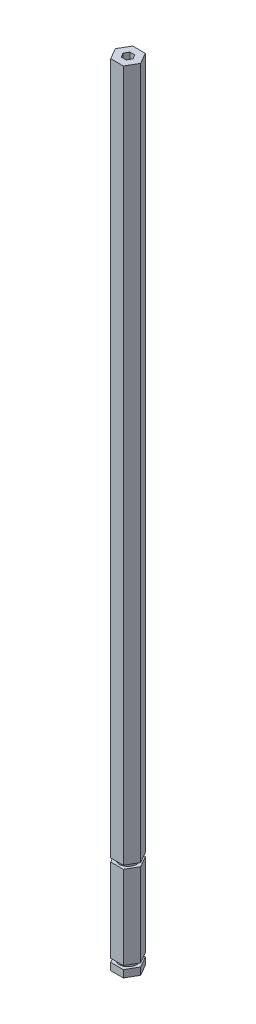
from build123d import *

# Parameters (mm, degrees)
BOSS_EXTRUDE1_DEPTH = 457.2
SKETCH3_W           = 2.54
SKETCH3_H           = 2.032


with BuildPart() as part:
    # Sketch1 → Boss-Extrude1 (new body)
    with BuildSketch(Plane(origin=(0, 0, 0), x_dir=(1, 0, 0), z_dir=(0, 1, 0))):
        Polygon((7.332348419, 0), (3.666174209, 6.35), (-3.666174209, 6.35), (-7.332348419, 0), (-3.666174209, -6.35), (3.666174209, -6.35), align=None)
        Polygon((1.443375673, 2.5), (-1.443375673, 2.5), (-2.886751346, 0), (-1.443375673, -2.5), (1.443375673, -2.5), (2.886751346, 0), align=None, mode=Mode.SUBTRACT)
    extrude(amount=BOSS_EXTRUDE1_DEPTH)

    # Sketch3 → Cut-Revolve2 (revolve, cut)
    with BuildSketch(Plane(origin=(0, 0, 0), x_dir=(0, 0, -1), z_dir=(1, 0, 0)), mode=Mode.PRIVATE) as cut_revolve2_sk:
        with Locations((6.2865, 55.499)):
            Rectangle(SKETCH3_W, SKETCH3_H)
        with Locations((6.2865, 5.207)):
            Rectangle(SKETCH3_W, SKETCH3_H)
    revolve(cut_revolve2_sk.sketch.rotate(Axis((0, 457.2, 0), (0, -1, 0)), 180), axis=Axis((0, 457.2, 0), (0, -1, 0)), mode=Mode.SUBTRACT)


solid = part.part
